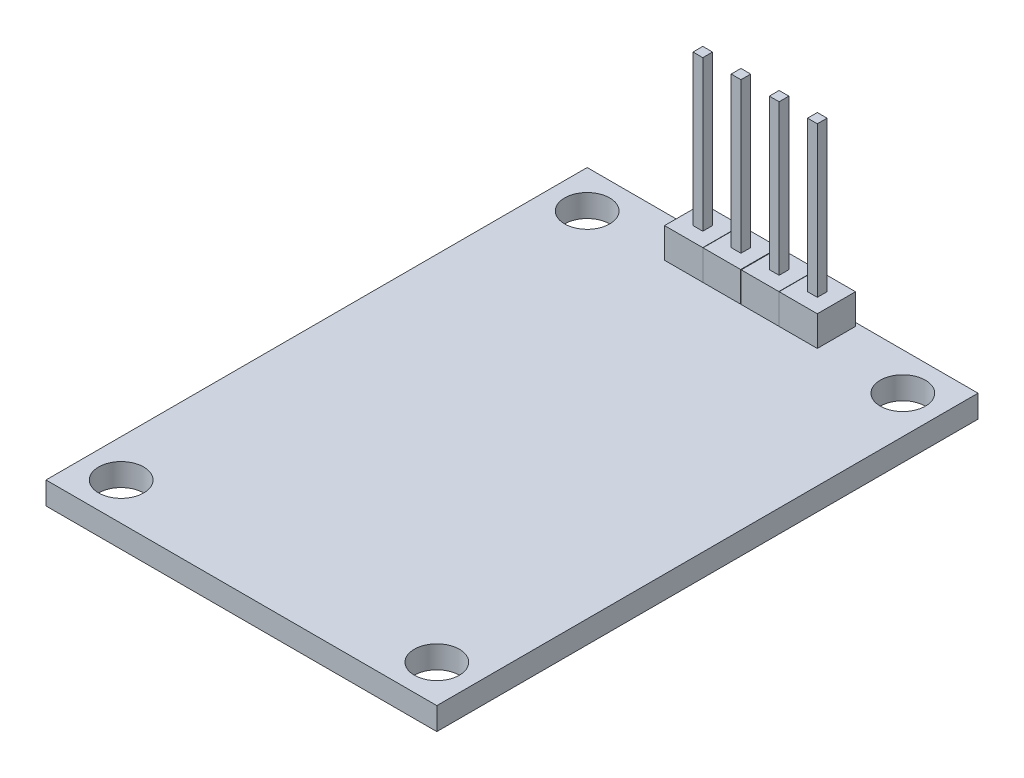
from build123d import *

# Parameters (mm, degrees)
SKETCH1_W                = 26
SKETCH1_H                = 36
BOSS_EXTRUDE1_DEPTH      = 1.5
SKETCH2_R                = 1.5
CUT_EXTRUDE1_DEPTH       = 1.5
SKETCH3_W                = 2.5
SKETCH3_H                = 2.54
SKETCH3_W_2              = 2.54
BOSS_EXTRUDE2_DEPTH      = 2
BOSS_EXTRUDE3_DEPTH      = 10
BOSS_EXTRUDE3_DEPTH_BACK = 5
SKETCH4_W                = 0.65
SKETCH4_H                = 0.65
SKETCH5_W                = 15
SKETCH5_H                = 11.5
BOSS_EXTRUDE4_DEPTH      = 2.5
SKETCH6_W                = 1.833556109
SKETCH6_H                = 1.290280226
SKETCH6_W_2              = 1.969375081
SKETCH6_W_3              = 1.697737138
SKETCH6_W_4              = 1.561918168
BOSS_EXTRUDE5_DEPTH      = 1.5
FILLET1_R                = 0.5
CUT_EXTRUDE2_DEPTH       = 0.5
L_EK1_SCALE              = 0.5


with BuildPart() as part:
    # Sketch1 → Boss-Extrude1 (new body)
    with BuildSketch(Plane(origin=(0, 0, 0), x_dir=(1, 0, 0), z_dir=(0, 1, 0))):
        Rectangle(SKETCH1_W, SKETCH1_H)
    extrude(amount=BOSS_EXTRUDE1_DEPTH)

    # Sketch2 → Cut-Extrude1 (cut)
    with BuildSketch(Plane(origin=(0, 1.5, 0), x_dir=(1, 0, 0), z_dir=(0, 1, 0))):
        with Locations(Location((-10.5, 15.5, 0), (0, 0, 270))):
            Circle(SKETCH2_R)
        with Locations(Location((10.5, 15.5, 0), (0, 0, 270))):
            Circle(SKETCH2_R)
        with Locations(Location((10.5, -15.5, 0), (0, 0, 270))):
            Circle(SKETCH2_R)
        with Locations(Location((-10.5, -15.5, 0), (0, 0, 270))):
            Circle(SKETCH2_R)
    extrude(amount=-CUT_EXTRUDE1_DEPTH, mode=Mode.SUBTRACT)

    # Sketch3 → Boss-Extrude2 (add)
    with BuildSketch(Plane(origin=(0, 1.5, 0), x_dir=(1, 0, 0), z_dir=(0, 1, 0))):
        with Locations((1.27, 16.5)):
            Rectangle(SKETCH3_W, SKETCH3_H)
        with Locations((-3.81, 16.5)):
            Rectangle(SKETCH3_W_2, SKETCH3_H)
        with Locations((3.81, 16.5)):
            Rectangle(SKETCH3_W_2, SKETCH3_H)
        with Locations((-1.27, 16.5)):
            Rectangle(SKETCH3_W, SKETCH3_H)
    extrude(amount=BOSS_EXTRUDE2_DEPTH)

    # Sketch4 → Boss-Extrude3 (add, two sides: drawn at the far end of the back side and taken through both)
    with BuildSketch(Plane(origin=(0, 3.5, 0), x_dir=(1, 0, 0), z_dir=(0, 1, 0)).offset(-BOSS_EXTRUDE3_DEPTH_BACK)):
        with Locations((-3.81, 16.5)):
            Rectangle(SKETCH4_W, SKETCH4_H)
        with Locations((-1.27, 16.5)):
            Rectangle(SKETCH4_W, SKETCH4_H)
        with Locations((1.27, 16.5)):
            Rectangle(SKETCH4_W, SKETCH4_H)
        with Locations((3.81, 16.5)):
            Rectangle(SKETCH4_W, SKETCH4_H)
    extrude(amount=BOSS_EXTRUDE3_DEPTH + BOSS_EXTRUDE3_DEPTH_BACK)

    # Sketch5 → Boss-Extrude4 (add)
    with BuildSketch(Plane.XZ):
        with Locations((0, 0.75)):
            Rectangle(SKETCH5_W, SKETCH5_H)
    extrude(amount=BOSS_EXTRUDE4_DEPTH)

    # Sketch6 → Boss-Extrude5 (add)
    with BuildSketch(Plane.XZ):
        with Locations((1.078775567, -11.02953631)):
            Rectangle(SKETCH6_W, SKETCH6_H)
        with Locations((3.455607561, -11.02953631)):
            Rectangle(SKETCH6_W_2, SKETCH6_H)
        with Locations((5.832439554, -11.02953631)):
            Rectangle(SKETCH6_W_3, SKETCH6_H)
        with Locations((8.039497834, -11.02953631)):
            Rectangle(SKETCH6_W_4, SKETCH6_H)
    extrude(amount=BOSS_EXTRUDE5_DEPTH)

    # Fillet1
    fillet1_edges = [part.edges().sort_by_distance(p)[0] for p in [
        (7.5, -2.5, 0.75),
        (0, -2.5, 6.5),
        (-7.5, -2.5, 0.75),
        (0, -2.5, -5),
    ]]
    fillet(fillet1_edges, radius=FILLET1_R)

    # Sketch7 → Cut-Extrude2 (cut)
    # profile 1 of 3: a face of its own
    with BuildSketch(Plane.XZ.offset(2.5)):
        with BuildLine():
            Line((-0.95224416, 1.042060188), (-1.221474929, 0.786851855))
            add(Edge.make_bspline(
                [(-1.221474929, 0.786851855), (-1.270193817, 0.832682718), (-1.366469864, 0.923251581), (-1.523430107, 1.040762576), (-1.687193741, 1.141428676), (-1.856906237, 1.223334912), (-2.028364791, 1.288687673), (-2.199293568, 1.335215813), (-2.367939269, 1.364888351), (-2.480106487, 1.36843672), (-2.535377173, 1.370185188)],
                knots=[0, 0, 0, 0, 1.08915593, 2.152340314, 3.188132944, 4.216796309, 5.218260357, 6.173443236, 7.099959455, 8, 8, 8, 8], degree=3))
            add(Edge.make_bspline(
                [(-2.535377173, 1.370185188), (-2.569291873, 1.369771582), (-2.637033313, 1.368945443), (-2.737655257, 1.358401228), (-2.837221894, 1.343236364), (-2.935545269, 1.321294486), (-3.032816556, 1.293485427), (-3.128697448, 1.258699963), (-3.223366803, 1.218144719), (-3.315932884, 1.171282245), (-3.405673387, 1.119802399), (-3.490430223, 1.062753858), (-3.570743622, 1.001965068), (-3.645104047, 0.935914089), (-3.713939234, 0.865199224), (-3.778887606, 0.791135918), (-3.837664901, 0.711700699), (-3.890756066, 0.628355073), (-3.938117685, 0.542562884), (-3.979926338, 0.455149894), (-4.015023426, 0.36640604), (-4.042792882, 0.276219962), (-4.065703536, 0.185289372), (-4.081821143, 0.092984652), (-4.090907865, -0.000793034), (-4.092479645, -0.063590292), (-4.093269801, -0.095159363)],
                knots=[0, 0, 0, 0, 1.02818874, 2.053710826, 3.065248034, 4.081641283, 5.106893873, 6.131558223, 7.173050175, 8.228653731, 9.27666206, 10.308777013, 11.325269123, 12.329503258, 13.32196095, 14.316845687, 15.314881793, 16.315733098, 17.311955233, 18.285320748, 19.252783886, 20.203351036, 21.145449891, 22.095197417, 23.042428769, 24, 24, 24, 24], degree=3))
            add(Edge.make_bspline(
                [(-4.093269801, -0.095159363), (-4.092514083, -0.12743018), (-4.09100471, -0.191883694), (-4.08134439, -0.288077767), (-4.06341615, -0.382843169), (-4.039448441, -0.476491302), (-4.009467625, -0.56918255), (-3.972094959, -0.66051506), (-3.927829359, -0.750485451), (-3.876592807, -0.838283068), (-3.820406603, -0.923806091), (-3.757463522, -1.004365613), (-3.690602939, -1.08103439), (-3.617389039, -1.152110154), (-3.540169497, -1.21949405), (-3.456637221, -1.281329572), (-3.36843476, -1.338807796), (-3.275427548, -1.391204315), (-3.178624766, -1.438012851), (-3.079368013, -1.479636747), (-2.977340197, -1.513916084), (-2.873077508, -1.541854188), (-2.766704236, -1.564754485), (-2.657680433, -1.579486966), (-2.546807725, -1.590177797), (-2.472069093, -1.590959467), (-2.434415634, -1.591353273)],
                knots=[0, 0, 0, 0, 0.93586088, 1.869166235, 2.799637598, 3.729985548, 4.670839027, 5.622275134, 6.589130586, 7.576015415, 8.568469353, 9.55398029, 10.53834874, 11.515998671, 12.510579167, 13.508179873, 14.527009472, 15.561807829, 16.601455013, 17.643573243, 18.680854198, 19.719860599, 20.772568776, 21.833555941, 22.908541556, 24, 24, 24, 24], degree=3))
            add(Edge.make_bspline(
                [(-2.434415634, -1.591353273), (-2.389037287, -1.590404697), (-2.29992953, -1.588542013), (-2.168943087, -1.574041724), (-2.043140016, -1.55139493), (-1.922873813, -1.518229034), (-1.808004792, -1.475925359), (-1.698111851, -1.424929972), (-1.594060192, -1.363286913), (-1.495537019, -1.293713046), (-1.404779833, -1.216198214), (-1.322925709, -1.132553758), (-1.25128022, -1.043185692), (-1.188775521, -0.948620376), (-1.137066867, -0.848075071), (-1.094624071, -0.742042509), (-1.06209078, -0.630474997), (-1.048735805, -0.553383365), (-1.04198775, -0.514430197)],
                knots=[0, 0, 0, 0, 1.13008108, 2.219097802, 3.278683437, 4.311054135, 5.322181354, 6.324827112, 7.324222904, 8.330512327, 9.32562643, 10.293043162, 11.24128371, 12.174520618, 13.111833804, 14.052305215, 15.015860969, 16, 16, 16, 16], degree=3))
            Line((-1.04198775, -0.514430197), (-2.208654416, -0.514430197))
            Line((-2.208654416, -0.514430197), (-2.208654416, -0.155455838))
            Line((-2.208654416, -0.155455838), (-0.727885186, -0.155455838))
            add(Edge.make_bspline(
                [(-0.727885186, -0.155455838), (-0.729591034, -0.222363326), (-0.732929687, -0.353313368), (-0.756348603, -0.544283639), (-0.794165115, -0.724655332), (-0.845825427, -0.894618404), (-0.912700708, -1.053931997), (-0.994073236, -1.202757863), (-1.091245357, -1.340134544), (-1.200755799, -1.467183547), (-1.323655756, -1.58051276), (-1.456624376, -1.680118697), (-1.599881345, -1.764021313), (-1.753291152, -1.832281975), (-1.916351586, -1.88555597), (-2.089439965, -1.923327547), (-2.272321566, -1.94595751), (-2.397658243, -1.94884889), (-2.461759384, -1.950327632)],
                knots=[0, 0, 0, 0, 1.140356446, 2.231883559, 3.274166699, 4.278491846, 5.25512956, 6.21435461, 7.1637429, 8.11826594, 9.068280886, 10.0076534, 10.945064095, 11.891975133, 12.864533718, 13.863980011, 14.907571808, 16, 16, 16, 16], degree=3))
            add(Edge.make_bspline(
                [(-2.461759384, -1.950327632), (-2.50126952, -1.949758511), (-2.579196241, -1.948636021), (-2.694287169, -1.940658673), (-2.806204789, -1.928378097), (-2.914932798, -1.909832974), (-3.02087114, -1.887118319), (-3.123490725, -1.858031601), (-3.223182467, -1.824362901), (-3.320100453, -1.786067228), (-3.413365, -1.741695571), (-3.503391517, -1.692385932), (-3.590677642, -1.638392571), (-3.674628807, -1.578781725), (-3.755682429, -1.513999265), (-3.833315872, -1.443915346), (-3.907963751, -1.368744226), (-3.954724214, -1.315365217), (-3.978285827, -1.288468658)],
                knots=[0, 0, 0, 0, 1.107784379, 2.184907829, 3.233506516, 4.263428166, 5.276301166, 6.270063455, 7.25232949, 8.225834625, 9.190232166, 10.146266622, 11.1027726, 12.066435141, 13.031522626, 14.010570082, 14.99756817, 16, 16, 16, 16], degree=3))
            add(Edge.make_bspline(
                [(-3.978285827, -1.288468658), (-4.012471759, -1.245798005), (-4.080276171, -1.161164988), (-4.167554328, -1.025565043), (-4.241955731, -0.885163183), (-4.302323553, -0.739568555), (-4.349461639, -0.588917342), (-4.383267892, -0.433402051), (-4.403075181, -0.27282242), (-4.405928719, -0.164157156), (-4.407372365, -0.109181799)],
                knots=[0, 0, 0, 0, 1.023165419, 2.029347347, 3.013907458, 3.994755782, 4.975994455, 5.96558838, 6.970761222, 8, 8, 8, 8], degree=3))
            add(Edge.make_bspline(
                [(-4.407372365, -0.109181799), (-4.406840127, -0.068015546), (-4.405782415, 0.013793761), (-4.392956899, 0.135251068), (-4.374555481, 0.254551761), (-4.347508426, 0.371598317), (-4.313412162, 0.486468909), (-4.270858676, 0.599216873), (-4.22131378, 0.709908744), (-4.163728284, 0.817782612), (-4.099643824, 0.921407025), (-4.030093604, 1.020364828), (-3.954090003, 1.112853893), (-3.872874204, 1.200045542), (-3.785477214, 1.280844389), (-3.69271779, 1.355998499), (-3.594524447, 1.425608685), (-3.490588267, 1.48857852), (-3.382460583, 1.54514214), (-3.270400581, 1.594731352), (-3.15444247, 1.635714667), (-3.035454993, 1.670488447), (-2.912537492, 1.696203588), (-2.786581955, 1.714852333), (-2.656931843, 1.727612933), (-2.569295814, 1.728639188), (-2.524860346, 1.729159547)],
                knots=[0, 0, 0, 0, 1.008945113, 2.00506715, 2.99143336, 3.967273523, 4.948097931, 5.927297278, 6.919902385, 7.919676788, 8.923139349, 9.905703106, 10.883022732, 11.856032218, 12.825136022, 13.798837087, 14.781400844, 15.773989409, 16.776158564, 17.77167057, 18.775803737, 19.789618931, 20.80898985, 21.851988756, 22.910860228, 24, 24, 24, 24], degree=3))
            add(Edge.make_bspline(
                [(-2.524860346, 1.729159547), (-2.488622102, 1.728580055), (-2.416765923, 1.727430991), (-2.309840191, 1.719466343), (-2.204567177, 1.706842462), (-2.100790787, 1.689615675), (-1.99886442, 1.666151985), (-1.898497715, 1.6380737), (-1.799545179, 1.605381878), (-1.70231693, 1.566393031), (-1.606159214, 1.522139406), (-1.510537373, 1.472325984), (-1.415778127, 1.416100979), (-1.321717146, 1.353297444), (-1.227761288, 1.284994026), (-1.135396645, 1.209237202), (-1.042393701, 1.129014447), (-0.982591887, 1.071332263), (-0.95224416, 1.042060188)],
                knots=[0, 0, 0, 0, 0.985871117, 1.954866573, 2.915460327, 3.869826059, 4.81536089, 5.759505086, 6.70452669, 7.649098992, 8.607881297, 9.583363685, 10.581137262, 11.603961102, 12.659522466, 13.73993555, 14.853081303, 16, 16, 16, 16], degree=3))
        make_face()
    # profile 2 of 3: a face of its own
    with BuildSketch(Plane.XZ.offset(2.5)):
        with BuildLine():
            Line((-0.009936468, 1.639415957), (0.676461769, 1.639415957))
            add(Edge.make_bspline(
                [(0.676461769, 1.639415957), (0.723672676, 1.639364061), (0.814130868, 1.639264626), (0.943845924, 1.63624988), (1.061655656, 1.632223188), (1.167306037, 1.626641294), (1.261122135, 1.620044704), (1.342679434, 1.610792665), (1.412618991, 1.601132369), (1.45452544, 1.591310963), (1.47363725, 1.586831823)],
                knots=[0, 0, 0, 0, 1.415646017, 2.712440637, 3.8905458, 4.950247383, 5.884950622, 6.709939814, 7.411656543, 8, 8, 8, 8], degree=3))
            add(Edge.make_bspline(
                [(1.47363725, 1.586831823), (1.497830784, 1.580209873), (1.545647761, 1.567122011), (1.614548804, 1.540908288), (1.68010265, 1.509826123), (1.742534208, 1.474402183), (1.801076291, 1.433116618), (1.856602332, 1.387643001), (1.908622313, 1.336931432), (1.956843705, 1.281550692), (2.001128502, 1.222430482), (2.039258185, 1.158688253), (2.071185412, 1.091396949), (2.098568683, 1.020603378), (2.118277138, 0.945713054), (2.133124038, 0.867246342), (2.142547665, 0.785211652), (2.143450227, 0.729151784), (2.143909686, 0.700613874)],
                knots=[0, 0, 0, 0, 0.999701418, 1.975846123, 2.934577507, 3.890451536, 4.834027766, 5.787354733, 6.749476667, 7.726910423, 8.712836071, 9.690891519, 10.682875813, 11.679750201, 12.712814741, 13.765529915, 14.8625177, 16, 16, 16, 16], degree=3))
            add(Edge.make_bspline(
                [(2.143909686, 0.700613874), (2.143488261, 0.671836097), (2.142663715, 0.615530433), (2.13276743, 0.533157645), (2.119437239, 0.454439255), (2.098940186, 0.379549804), (2.072094513, 0.308934034), (2.04060246, 0.241512802), (2.00261893, 0.17843313), (1.9589741, 0.119466013), (1.910422506, 0.0645561), (1.857169568, 0.014101306), (1.799430275, -0.031603033), (1.737388127, -0.072659376), (1.670438278, -0.108115656), (1.599596125, -0.139872961), (1.524245908, -0.166544021), (1.472103394, -0.180574083), (1.445592378, -0.18770744)],
                knots=[0, 0, 0, 0, 1.121902311, 2.195077645, 3.232258892, 4.234102512, 5.217864754, 6.176164875, 7.132989551, 8.084763148, 9.034132444, 9.988522005, 10.94243251, 11.903244335, 12.886203696, 13.894208494, 14.929344452, 16, 16, 16, 16], degree=3))
            add(Edge.make_bspline(
                [(1.445592378, -0.18770744), (1.423665044, -0.192370421), (1.375610017, -0.202589615), (1.296467295, -0.213998072), (1.204321909, -0.223735673), (1.099299629, -0.23103681), (0.981494724, -0.237287179), (0.850843467, -0.242255273), (0.70708939, -0.244985127), (0.606818146, -0.245125919), (0.554466577, -0.245199427)],
                knots=[0, 0, 0, 0, 0.601384939, 1.31797006, 2.144135048, 3.087295005, 4.142315834, 5.309527816, 6.595305764, 8, 8, 8, 8], degree=3))
            Line((0.554466577, -0.245199427), (0.304166096, -0.245199427))
            Line((0.304166096, -0.245199427), (0.304166096, -1.860584043))
            Line((0.304166096, -1.860584043), (-0.009936468, -1.860584043))
            Line((-0.009936468, -1.860584043), (-0.009936468, 1.639415957))
        make_face()
        with BuildLine():
            Line((0.304166096, 1.280441598), (0.304166096, 0.113774932))
            Line((0.304166096, 0.113774932), (0.916946545, 0.106062592))
            add(Edge.make_bspline(
                [(0.916946545, 0.106062592), (0.946866471, 0.106047128), (1.004626271, 0.106017276), (1.088062494, 0.1100025), (1.165471781, 0.114603032), (1.236616357, 0.121338956), (1.301528291, 0.130860213), (1.36031582, 0.140471951), (1.412523103, 0.154377314), (1.473622305, 0.173100383), (1.541705652, 0.205032999), (1.615773201, 0.251382889), (1.678543787, 0.310463597), (1.732862084, 0.376891428), (1.775967962, 0.450790558), (1.807523954, 0.529859494), (1.826065112, 0.613287344), (1.828551305, 0.670375483), (1.829807122, 0.69921163)],
                knots=[0, 0, 0, 0, 1.160613943, 2.240541288, 3.23993089, 4.169200891, 5.011653406, 5.7853311, 6.478053781, 7.106038997, 8.262395093, 9.384106736, 10.481365981, 11.59014053, 12.70357646, 13.786202915, 14.881775077, 16, 16, 16, 16], degree=3))
            add(Edge.make_bspline(
                [(1.829807122, 0.69921163), (1.828544476, 0.727350144), (1.826034491, 0.783286026), (1.807378627, 0.865264787), (1.776029314, 0.943500491), (1.732572719, 1.016473576), (1.679831589, 1.08266238), (1.618532246, 1.140159507), (1.548818985, 1.18638121), (1.483970754, 1.216214492), (1.426369568, 1.234429767), (1.376337608, 1.247174608), (1.319846933, 1.257350214), (1.256879154, 1.265589717), (1.18792232, 1.272643178), (1.112384005, 1.277429155), (1.030550362, 1.280230611), (0.973739791, 1.280369567), (0.944290295, 1.280441598)],
                knots=[0, 0, 0, 0, 1.120700087, 2.227813068, 3.331159281, 4.466773991, 5.599788987, 6.693661531, 7.80175334, 8.91857717, 9.525282508, 10.207424825, 10.974604443, 11.810962634, 12.737642355, 13.736264703, 14.826523623, 16, 16, 16, 16], degree=3))
            Line((0.944290295, 1.280441598), (0.304166096, 1.280441598))
        make_face(mode=Mode.SUBTRACT)
    # profile 3 of 3: a face of its own
    with BuildSketch(Plane.XZ.offset(2.5)):
        with BuildLine():
            Line((2.502884045, -1.185403754), (2.798757443, -1.00801994))
            add(Edge.make_bspline(
                [(2.798757443, -1.00801994), (2.82627568, -1.054084325), (2.87899956, -1.142341909), (2.96695092, -1.261599949), (3.058083831, -1.362962106), (3.153073164, -1.445838714), (3.251339112, -1.5110876), (3.353523166, -1.557289832), (3.459280977, -1.586105808), (3.531254798, -1.589605894), (3.56718693, -1.591353273)],
                knots=[0, 0, 0, 0, 1.272034388, 2.437168799, 3.508375237, 4.49857839, 5.41946034, 6.295179144, 7.148887113, 8, 8, 8, 8], degree=3))
            add(Edge.make_bspline(
                [(3.56718693, -1.591353273), (3.59787379, -1.590498601), (3.658710563, -1.588804211), (3.748272806, -1.572523409), (3.835254609, -1.54751128), (3.917863246, -1.511690348), (3.994958861, -1.468351862), (4.062565556, -1.416005685), (4.121011669, -1.357399479), (4.168820784, -1.292016825), (4.205500819, -1.221699676), (4.233692888, -1.149523725), (4.249337961, -1.074355156), (4.251694715, -1.023744694), (4.252884045, -0.998204235)],
                knots=[0, 0, 0, 0, 1.095163259, 2.171163733, 3.241058638, 4.321873601, 5.38011039, 6.391990106, 7.366004449, 8.327778327, 9.272591725, 10.192022065, 11.087607919, 12, 12, 12, 12], degree=3))
            add(Edge.make_bspline(
                [(4.252884045, -0.998204235), (4.251409734, -0.969063385), (4.248412676, -0.909824296), (4.223081196, -0.822424643), (4.183231949, -0.735932073), (4.146469306, -0.682430808), (4.127383244, -0.654654556)],
                knots=[0, 0, 0, 0, 0.938893495, 1.908633276, 2.914225137, 4, 4, 4, 4], degree=3))
            add(Edge.make_bspline(
                [(4.127383244, -0.654654556), (4.11171263, -0.634607732), (4.078814135, -0.592521933), (4.022256623, -0.529876698), (3.955890508, -0.465258279), (3.881986954, -0.396199222), (3.797853865, -0.325911425), (3.70612635, -0.251043147), (3.604462491, -0.17444157), (3.533162995, -0.123069005), (3.496373628, -0.096561607)],
                knots=[0, 0, 0, 0, 0.722233717, 1.516239348, 2.393582979, 3.351407094, 4.387010283, 5.505090956, 6.712668013, 8, 8, 8, 8], degree=3))
            add(Edge.make_bspline(
                [(3.496373628, -0.096561607), (3.459549632, -0.070333019), (3.389144956, -0.020185957), (3.290686373, 0.054238327), (3.20264191, 0.122282197), (3.125402894, 0.184586209), (3.059003297, 0.241158813), (3.002919886, 0.291456753), (2.958581329, 0.336840313), (2.933925748, 0.366281655), (2.922856, 0.379500092)],
                knots=[0, 0, 0, 0, 1.452282411, 2.77665338, 3.964542531, 5.026858415, 5.96415736, 6.766646006, 7.446254459, 8, 8, 8, 8], degree=3))
            add(Edge.make_bspline(
                [(2.922856, 0.379500092), (2.907383455, 0.400101129), (2.876954618, 0.440615833), (2.836788613, 0.50394069), (2.80264945, 0.568763956), (2.775887118, 0.63525982), (2.753350899, 0.702494749), (2.738192968, 0.771345995), (2.728701571, 0.841504613), (2.727729585, 0.888718114), (2.727243019, 0.912352656)],
                knots=[0, 0, 0, 0, 1.068054152, 2.10047183, 3.106115577, 4.101338837, 5.06977816, 6.043150881, 7.020423561, 8, 8, 8, 8], degree=3))
            add(Edge.make_bspline(
                [(2.727243019, 0.912352656), (2.728548228, 0.949382431), (2.731130749, 1.022650494), (2.752971266, 1.129681325), (2.787444159, 1.231867742), (2.835739047, 1.328198076), (2.8979964, 1.416164057), (2.970042375, 1.496777544), (3.055853861, 1.564546126), (3.150006484, 1.623758184), (3.253062856, 1.670104109), (3.36105376, 1.70506509), (3.474150832, 1.724874347), (3.550753966, 1.727717112), (3.589622827, 1.729159547)],
                knots=[0, 0, 0, 0, 1.005424448, 1.989358655, 2.955360095, 3.929531133, 4.905563448, 5.876582895, 6.856512386, 7.866279853, 8.892233794, 9.918561126, 10.94386622, 12, 12, 12, 12], degree=3))
            add(Edge.make_bspline(
                [(3.589622827, 1.729159547), (3.630866927, 1.727736995), (3.712888279, 1.724907994), (3.833537495, 1.700310463), (3.949698211, 1.659609791), (4.043141476, 1.613421133), (4.116274237, 1.567289718), (4.17204697, 1.525269893), (4.228564421, 1.476894785), (4.286282476, 1.422035539), (4.344223135, 1.360188787), (4.403246587, 1.291778099), (4.463490856, 1.217221543), (4.502246716, 1.163997042), (4.522114814, 1.13671163)],
                knots=[0, 0, 0, 0, 1.286793592, 2.559021753, 3.825965368, 5.121522368, 5.803751409, 6.523245864, 7.299691795, 8.125521123, 9.008227632, 9.944561021, 10.946284179, 12, 12, 12, 12], degree=3))
            Line((4.522114814, 1.13671163), (4.238160487, 0.921467239))
            add(Edge.make_bspline(
                [(4.238160487, 0.921467239), (4.221014555, 0.94355593), (4.187995498, 0.986093583), (4.137866011, 1.045664899), (4.090617363, 1.100081378), (4.044066963, 1.147346506), (4.000673332, 1.19004864), (3.95855629, 1.226608396), (3.918321938, 1.257383992), (3.867605028, 1.290227552), (3.803887309, 1.322784055), (3.723902773, 1.350333133), (3.640316498, 1.366888195), (3.583386867, 1.369077083), (3.554566737, 1.370185188)],
                knots=[0, 0, 0, 0, 1.181633172, 2.275549214, 3.290209073, 4.226197932, 5.078386478, 5.862611352, 6.581680152, 7.217281963, 8.414376989, 9.595101626, 10.782541182, 12, 12, 12, 12], degree=3))
            add(Edge.make_bspline(
                [(3.554566737, 1.370185188), (3.518410215, 1.368973488), (3.448685768, 1.366636839), (3.349695532, 1.341116854), (3.260601606, 1.300934993), (3.184049041, 1.244620015), (3.120312064, 1.177899023), (3.074206606, 1.101120167), (3.046456441, 1.016337765), (3.043070161, 0.957196109), (3.041345584, 0.927076214)],
                knots=[0, 0, 0, 0, 1.14458467, 2.207223713, 3.21896685, 4.227309161, 5.202851033, 6.127160689, 7.046193047, 8, 8, 8, 8], degree=3))
            add(Edge.make_bspline(
                [(3.041345584, 0.927076214), (3.04173871, 0.908324735), (3.042525606, 0.870791116), (3.053500404, 0.815339694), (3.067599733, 0.760028354), (3.089942365, 0.705105772), (3.120787668, 0.649611412), (3.161292844, 0.592589675), (3.212306156, 0.533537966), (3.251383169, 0.495130592), (3.272014654, 0.474852656)],
                knots=[0, 0, 0, 0, 0.858281714, 1.717966888, 2.583508476, 3.4729293, 4.427298488, 5.488583878, 6.674047936, 8, 8, 8, 8], degree=3))
            add(Edge.make_bspline(
                [(3.272014654, 0.474852656), (3.279676027, 0.46801563), (3.297877694, 0.451772422), (3.331153619, 0.425180141), (3.375096418, 0.392377369), (3.428558619, 0.351790052), (3.492525981, 0.30470859), (3.567005537, 0.251734978), (3.65116707, 0.191149519), (3.710888985, 0.148791979), (3.742467378, 0.126395124)],
                knots=[0, 0, 0, 0, 0.420754252, 0.999615792, 1.744751191, 2.668019286, 3.750313428, 4.999500688, 6.413464383, 8, 8, 8, 8], degree=3))
            add(Edge.make_bspline(
                [(3.742467378, 0.126395124), (3.780453292, 0.098753764), (3.854007748, 0.045230103), (3.958665328, -0.035185577), (4.053559136, -0.113833346), (4.13902234, -0.190210953), (4.215899248, -0.263739046), (4.283336969, -0.335302226), (4.342022649, -0.404387799), (4.405201868, -0.492960375), (4.469759687, -0.601741459), (4.525201195, -0.735019698), (4.560159542, -0.868816018), (4.564731057, -0.958742855), (4.566986609, -1.003112088)],
                knots=[0, 0, 0, 0, 1.163667725, 2.253281268, 3.268753668, 4.215851969, 5.092017293, 5.902905408, 6.650798638, 7.335211899, 8.59617414, 9.77448103, 10.901945474, 12, 12, 12, 12], degree=3))
            add(Edge.make_bspline(
                [(4.566986609, -1.003112088), (4.566329471, -1.034490453), (4.565027956, -1.096637836), (4.550067042, -1.187892913), (4.528147377, -1.276523783), (4.495110143, -1.361434895), (4.454786985, -1.444179658), (4.403620737, -1.522587558), (4.344313052, -1.598393957), (4.276279287, -1.669577448), (4.201833385, -1.734923644), (4.12314969, -1.793052706), (4.040099417, -1.841521029), (3.953133101, -1.881071871), (3.862230764, -1.912005389), (3.76742298, -1.934418258), (3.668553469, -1.948173969), (3.601352987, -1.94960173), (3.56718693, -1.950327632)],
                knots=[0, 0, 0, 0, 0.983748083, 1.948392443, 2.894712957, 3.844097841, 4.80183111, 5.778335162, 6.776009319, 7.81870978, 8.863265674, 9.881300176, 10.883814829, 11.87499822, 12.874611388, 13.892143829, 14.928324115, 16, 16, 16, 16], degree=3))
            add(Edge.make_bspline(
                [(3.56718693, -1.950327632), (3.540751587, -1.949816451), (3.488213827, -1.948800525), (3.410504345, -1.939819245), (3.334364756, -1.927112141), (3.260750474, -1.906938071), (3.188713062, -1.882461094), (3.118565827, -1.852322762), (3.050274774, -1.81620556), (2.983457191, -1.774910536), (2.918283016, -1.726852791), (2.855363548, -1.670879295), (2.792634363, -1.60853379), (2.731946966, -1.538123226), (2.672073822, -1.460785144), (2.614195413, -1.37579596), (2.557113695, -1.283618606), (2.521298227, -1.218753521), (2.502884045, -1.185403754)],
                knots=[0, 0, 0, 0, 0.915332311, 1.819136955, 2.706846663, 3.586547465, 4.459518054, 5.340707479, 6.227863349, 7.133153174, 8.059268498, 9.028702269, 10.047606654, 11.120612155, 12.245963614, 13.433783089, 14.680604001, 16, 16, 16, 16], degree=3))
        make_face()
    extrude(amount=-CUT_EXTRUDE2_DEPTH, mode=Mode.SUBTRACT)


with BuildPart() as part_1:
    # Ölçek1: scaled about (0.032079159, 0.405374485, -0.532051644)
    add(part.part.scale(L_EK1_SCALE).moved(Location((0.01603958, 0.202687243, -0.266025822))))


solid = part_1.part
